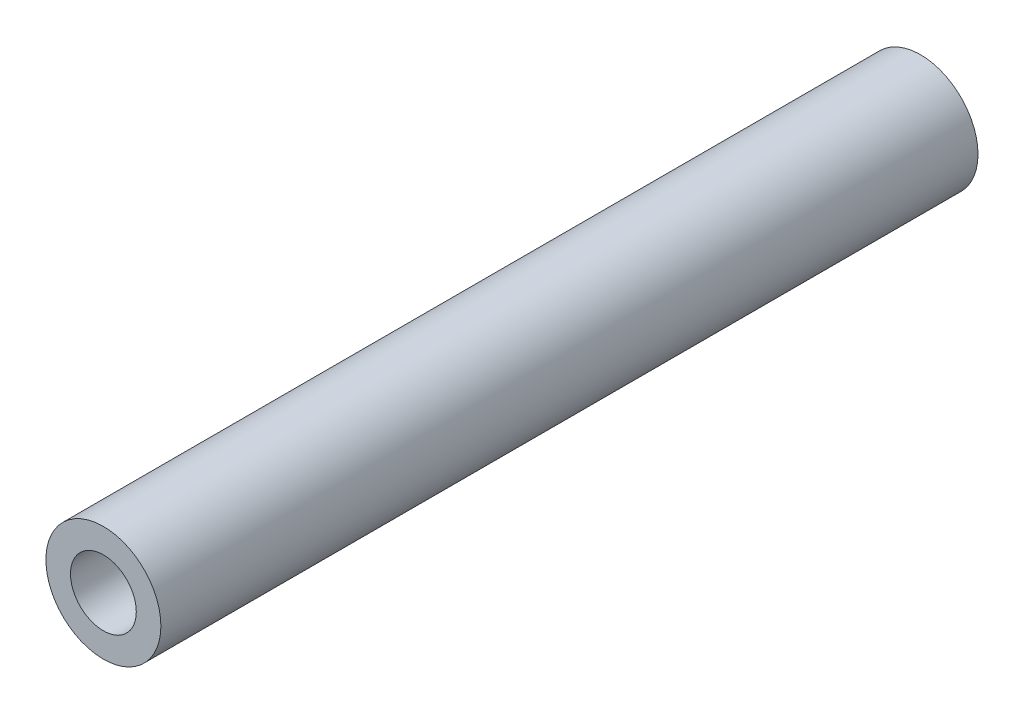
from build123d import *

# Parameters (mm, degrees)
SKETCH1_R           = 4.63
SKETCH1_R_2         = 2.65
BOSS_EXTRUDE1_DEPTH = 65.8


with BuildPart() as part:
    # Sketch1 → Boss-Extrude1 (new body)
    with BuildSketch(Plane.XY):
        with Locations((1803.99117355, -1743.849409116)):
            Circle(SKETCH1_R)
        with Locations((1803.99117355, -1743.849409116)):
            Circle(SKETCH1_R_2, mode=Mode.SUBTRACT)
    extrude(amount=BOSS_EXTRUDE1_DEPTH)


solid = part.part
